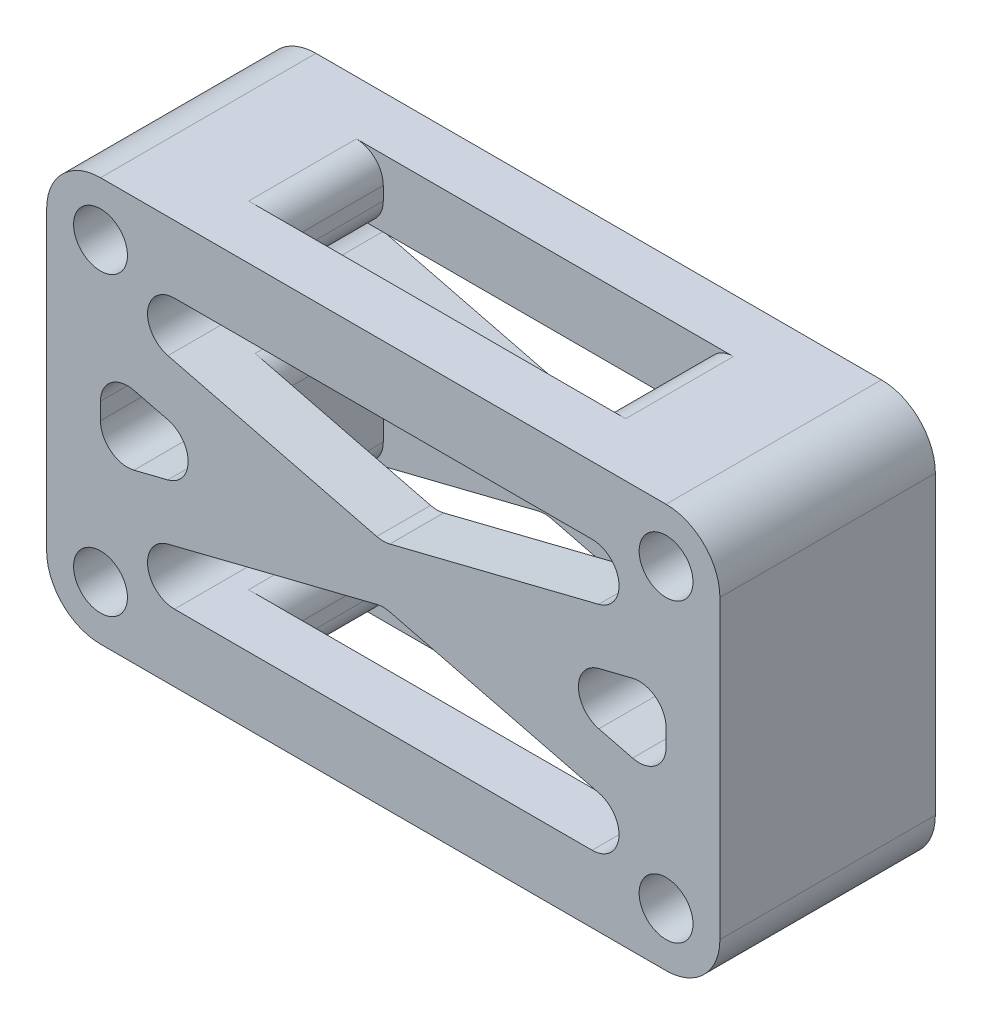
from build123d import *

# Parameters (mm, degrees)
SKETCH_1_W               = 25
SKETCH_1_H               = 15
EXTRUDE_1_DEPTH          = 8
FILLET_4_R               = 2
CUT_EXTRUDE_3_DEPTH      = 10
SKETCH_3_R               = 1
CUT_EXTRUDE_4_DEPTH      = 10
CUT_EXTRUDE_5_DEPTH      = 22.100947846
CUT_EXTRUDE_5_DEPTH_BACK = 22.100947846
SKETCH_4_W               = 12
SKETCH_4_H               = 4
FILLET_6_R               = 1


with BuildPart() as part:
    # 草图1 → 凸台-拉伸1 (new body)
    with BuildSketch(Plane.XY):
        Rectangle(SKETCH_1_W, SKETCH_1_H)
    extrude(amount=EXTRUDE_1_DEPTH)

    # 圆角4
    fillet_4_edges = [part.edges().sort_by_distance(p)[0] for p in [
        (12.5, -7.5, 4),
        (-12.5, -7.5, 4),
        (-12.5, 7.5, 4),
        (12.5, 7.5, 4),
    ]]
    fillet(fillet_4_edges, radius=FILLET_4_R)

    # 草图2 → 切除-拉伸3 (cut)
    with BuildSketch(Plane.XY.offset(8)):
        with BuildLine():
            Line((-0.242535625, -1.091410313), (-7.996324374, -3.0298575))
            ThreePointArc((-7.996324374, -3.0298575), (-8.746296305, -4.122183264), (-7.753788749, -5))
            Line((-7.753788749, -5), (7.753788749, -5))
            ThreePointArc((7.753788749, -5), (8.746296305, -4.122183264), (7.996324374, -3.0298575))
            Line((7.996324374, -3.0298575), (0.242535625, -1.091410313))
            ThreePointArc((0.242535625, -1.091410313), (0, -1.061552813), (-0.242535625, -1.091410313))
        make_face()
        with BuildLine():
            Line((7.753788749, 5), (-7.753788749, 5))
            ThreePointArc((-7.753788749, 5), (-8.746296305, 4.122183264), (-7.996324374, 3.0298575))
            Line((-7.996324374, 3.0298575), (-0.242535625, 1.091410313))
            ThreePointArc((-0.242535625, 1.091410313), (0, 1.061552813), (0.242535625, 1.091410313))
            Line((0.242535625, 1.091410313), (7.996324374, 3.0298575))
            ThreePointArc((7.996324374, 3.0298575), (8.746296305, 4.122183264), (7.753788749, 5))
        make_face()
        with BuildLine():
            Line((-9.257464375, -1.283589687), (-8.003675626, -0.9701425))
            ThreePointArc((-8.003675626, -0.9701425), (-7.246211251, 0), (-8.003675626, 0.9701425))
            Line((-8.003675626, 0.9701425), (-9.257464375, 1.283589687))
            ThreePointArc((-9.257464375, 1.283589687), (-10.115412209, 1.101652625), (-10.5, 0.313447187))
            Line((-10.5, 0.313447187), (-10.5, -0.313447187))
            ThreePointArc((-10.5, -0.313447187), (-10.115412209, -1.101652625), (-9.257464375, -1.283589687))
        make_face()
        with BuildLine():
            Line((10.5, 0.313447187), (10.5, -0.313447187))
            ThreePointArc((10.5, -0.313447187), (10.115412209, -1.101652625), (9.257464375, -1.283589687))
            Line((9.257464375, -1.283589687), (8.003675626, -0.9701425))
            ThreePointArc((8.003675626, -0.9701425), (7.246211251, 0), (8.003675626, 0.9701425))
            Line((8.003675626, 0.9701425), (9.257464375, 1.283589687))
            ThreePointArc((9.257464375, 1.283589687), (10.115412209, 1.101652625), (10.5, 0.313447187))
        make_face()
    extrude(amount=-CUT_EXTRUDE_3_DEPTH, mode=Mode.SUBTRACT)

    # 草图3 → 切除-拉伸4 (cut)
    with BuildSketch(Plane.XY.offset(8)):
        with Locations((-10.5, 5.5)):
            Circle(SKETCH_3_R)
        with Locations(Location((10.5, 5.5, 0), (0, 0, 180))):
            Circle(SKETCH_3_R)
        with Locations((10.5, -5.5)):
            Circle(SKETCH_3_R)
        with Locations(Location((-10.5, -5.5, 0), (0, 0, 180))):
            Circle(SKETCH_3_R)
    extrude(amount=-CUT_EXTRUDE_4_DEPTH, mode=Mode.SUBTRACT)

    # 草图4 → 切除-拉伸5 (cut, two sides: drawn at the far end of the back side and taken through both)
    with BuildSketch(Plane.XZ.offset(7.5).offset(-CUT_EXTRUDE_5_DEPTH_BACK)):
        with Locations((0, 4)):
            Rectangle(SKETCH_4_W, SKETCH_4_H)
    extrude(amount=CUT_EXTRUDE_5_DEPTH + CUT_EXTRUDE_5_DEPTH_BACK, mode=Mode.SUBTRACT)

    # 圆角6
    fillet_6_edges = [part.edges().sort_by_distance(p)[0] for p in [
        (6, 2.530776406, 4),
        (-6, 5, 4),
        (-6, -7.5, 4),
        (-6, -5, 4),
        (-6, -2.530776406, 4),
        (-6, 2.530776406, 4),
        (-6, 7.5, 4),
        (6, -7.5, 4),
        (6, -5, 4),
        (6, -2.530776406, 4),
        (6, 5, 4),
        (6, 7.5, 4),
    ]]
    fillet(fillet_6_edges, radius=FILLET_6_R)


solid = part.part
